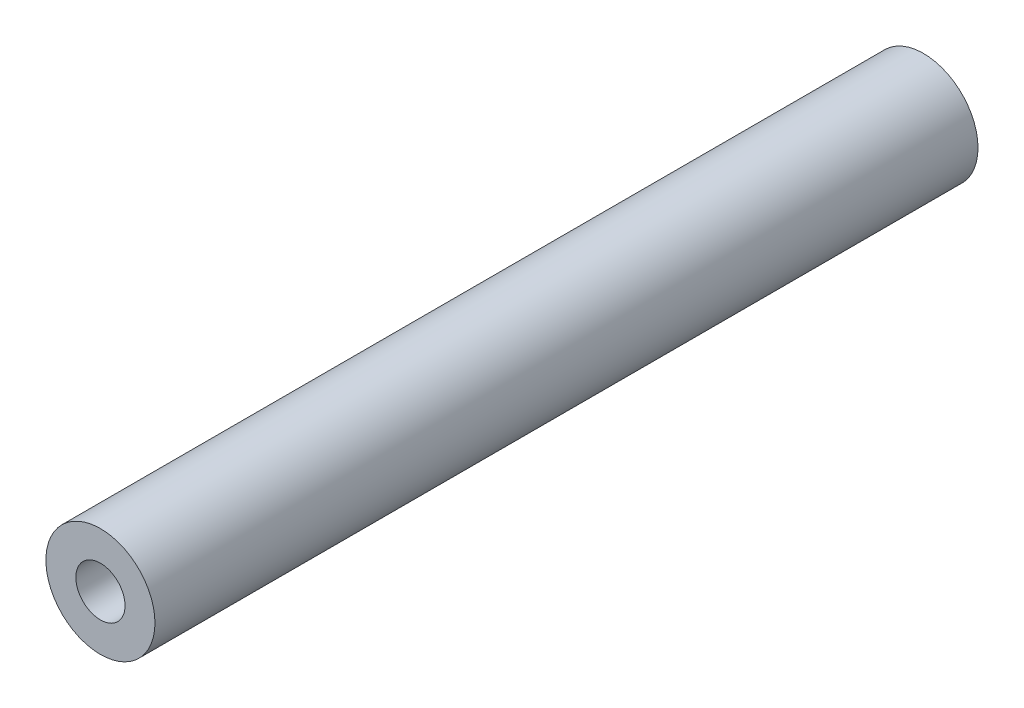
from build123d import *

# Parameters (mm, degrees)
SKETCH1_R                 = 3
BOSS_EXTRUDE1_DEPTH       = 45.28
F_6_32_TAPPED_HOLE1_D     = 2.7051
F_6_32_TAPPED_HOLE1_DEPTH = 10
F_6_32_TAPPED_HOLE1_TIP   = 0.81269403
F_6_32_TAPPED_HOLE2_D     = 2.7051
F_6_32_TAPPED_HOLE2_DEPTH = 10
F_6_32_TAPPED_HOLE2_TIP   = 0.81269403


with BuildPart() as part:
    # Sketch1 → Boss-Extrude1 (new body)
    with BuildSketch(Plane.XY):
        Circle(SKETCH1_R)
    extrude(amount=BOSS_EXTRUDE1_DEPTH)

    # #6-32 Tapped Hole1
    with Locations(Plane.XY.offset(45.28)):
        with Locations((0, 0)):
            Hole(F_6_32_TAPPED_HOLE1_D / 2, depth=F_6_32_TAPPED_HOLE1_DEPTH)
            with Locations((0, 0, -(F_6_32_TAPPED_HOLE1_DEPTH + F_6_32_TAPPED_HOLE1_TIP / 2))):  # 118° drill point
                Cone(0, F_6_32_TAPPED_HOLE1_D / 2, F_6_32_TAPPED_HOLE1_TIP, mode=Mode.SUBTRACT)

    # #6-32 Tapped Hole2
    with Locations(Plane(origin=(0, 0, 0), x_dir=(-1, 0, 0), z_dir=(0, 0, -1))):
        with Locations((0, 0)):
            Hole(F_6_32_TAPPED_HOLE2_D / 2, depth=F_6_32_TAPPED_HOLE2_DEPTH)
            with Locations((0, 0, -(F_6_32_TAPPED_HOLE2_DEPTH + F_6_32_TAPPED_HOLE2_TIP / 2))):  # 118° drill point
                Cone(0, F_6_32_TAPPED_HOLE2_D / 2, F_6_32_TAPPED_HOLE2_TIP, mode=Mode.SUBTRACT)


solid = part.part
